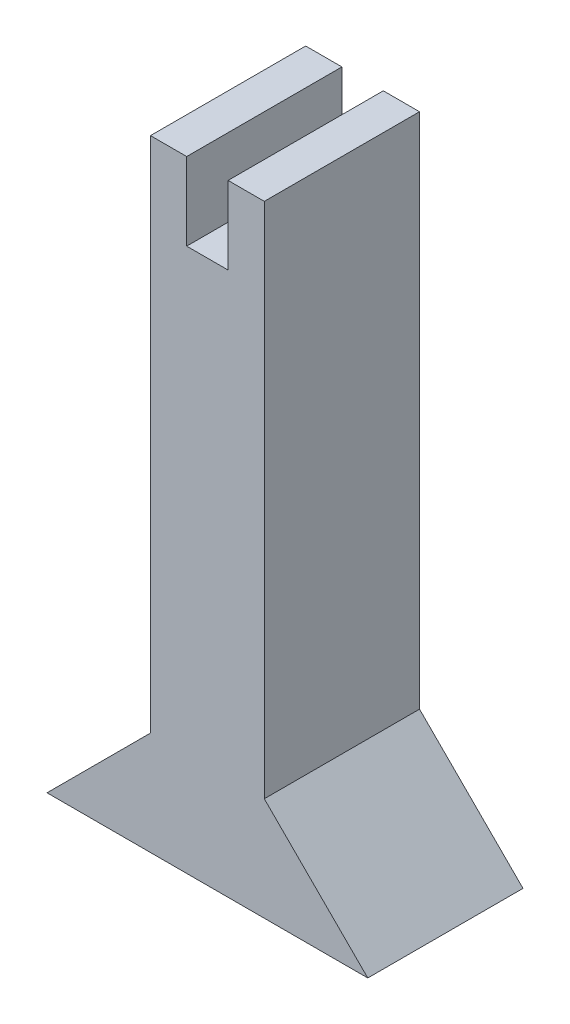
from build123d import *

# Parameters (mm, degrees)
BOSS_EXTRUDE1_DEPTH = 30
BOSS_EXTRUDE2_DEPTH = 30


with BuildPart() as part:
    # Sketch1 → Boss-Extrude1 (new body)
    with BuildSketch(Plane.XY):
        Polygon((0, 0), (8, 0), (8, 15), (15, 15), (15, -105), (-7, -105), (-7, 15), (0, 15), align=None)
    extrude(amount=BOSS_EXTRUDE1_DEPTH)

    # Sketch2 → Boss-Extrude2 (add)
    with BuildSketch(Plane.XY.offset(30)):
        Polygon((15, -85), (35, -105), (15, -105), align=None)
    boss_extrude2 = extrude(amount=-BOSS_EXTRUDE2_DEPTH)

    # Mirror1: Boss-Extrude2 across plane
    add(boss_extrude2.mirror(Plane.ZY.offset(-4)))


solid = part.part
